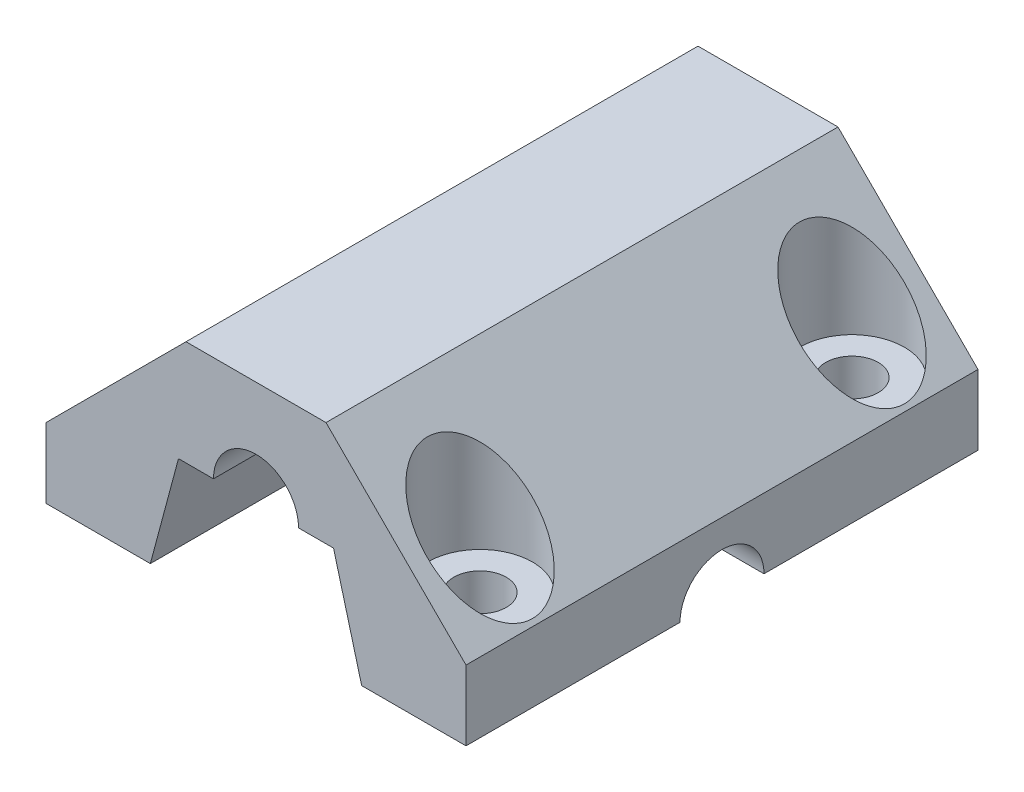
from build123d import *

# Parameters (mm, degrees)
SKETCH1_W           = 60
SKETCH1_H           = 30
BOSS_EXTRUDE1_DEPTH = 36.57
CUT_EXTRUDE1_DEPTH  = 60
CUT_EXTRUDE2_REACH  = 82.464
CUT_EXTRUDE3_DEPTH  = 73.14
SKETCH5_R           = 3.75
CUT_EXTRUDE4_DEPTH  = 30
SKETCH6_R           = 7.5
CUT_EXTRUDE5_DEPTH  = 20


with BuildPart() as part:
    # Sketch1 → Boss-Extrude1 (new, symmetric)
    with BuildSketch(Plane.XY):
        Rectangle(SKETCH1_W, SKETCH1_H)
    extrude(amount=BOSS_EXTRUDE1_DEPTH, both=True)

    # Sketch2 → Cut-Extrude1 (cut)
    with BuildSketch(Plane(origin=(30, 0, 0), x_dir=(0, 0, -1), z_dir=(1, 0, 0))):
        with BuildLine():
            ThreePointArc((6, -15), (0, -9), (-6, -15))
            Line((-6, -15), (6, -15))
        make_face()
    extrude(amount=-CUT_EXTRUDE1_DEPTH, mode=Mode.SUBTRACT)

    # Cut-Extrude2: up to this face of the body (flat: up to its plane)
    cut_extrude2_end = Plane(part.part.faces().sort_by_distance((0, 0, -36.57))[0])
    # Sketch3 → Cut-Extrude2 (cut, up to the picked face)
    with BuildSketch(Plane.XY.offset(36.57), mode=Mode.PRIVATE) as cut_extrude2_sk1:
        with BuildLine():
            Line((6.075, 0), (11.075, 0))
            Line((11.075, 0), (15.094237886, -15))
            Line((15.094237886, -15), (-15.094237886, -15))
            Line((-15.094237886, -15), (-11.075, 0))
            Line((-11.075, 0), (-6.075, 0))
            ThreePointArc((-6.075, 0), (0, 6.075), (6.075, 0))
        make_face()
    cut_extrude2_tool1 = split(extrude(cut_extrude2_sk1.sketch, amount=-CUT_EXTRUDE2_REACH, mode=Mode.PRIVATE), bisect_by=cut_extrude2_end, keep=Keep.BOTH, mode=Mode.PRIVATE)
    add(cut_extrude2_tool1.solids().sort_by(Axis((0, -6.537689, 36.57), (0, 0, -1)))[0], mode=Mode.SUBTRACT)

    # Sketch4 → Cut-Extrude3 (cut)
    with BuildSketch(Plane.XY.offset(36.57)):
        Polygon((30, 15), (30, -5), (10, 15), align=None)
        Polygon((-30, 15), (-30, -5), (-10, 15), align=None)
    extrude(amount=-CUT_EXTRUDE3_DEPTH, mode=Mode.SUBTRACT)

    # Sketch5 → Cut-Extrude4 (cut)
    with BuildSketch(Plane(origin=(0, 15, 0), x_dir=(1, 0, 0), z_dir=(0, 1, 0))):
        with Locations(Location((22, -26.57, 0), (0, 0, 180))):
            Circle(SKETCH5_R)
        with Locations(Location((-22, -26.57, 0), (0, 0, 180))):
            Circle(SKETCH5_R)
        with Locations(Location((22, 26.57, 0), (0, 0, 180))):
            Circle(SKETCH5_R)
        with Locations(Location((-22, 26.57, 0), (0, 0, 180))):
            Circle(SKETCH5_R)
    extrude(amount=-CUT_EXTRUDE4_DEPTH, mode=Mode.SUBTRACT)

    # Sketch6 → Cut-Extrude5 (cut)
    with BuildSketch(Plane(origin=(0, 15, 0), x_dir=(1, 0, 0), z_dir=(0, 1, 0))):
        with Locations(Location((22, -26.57, 0), (0, 0, 180))):
            Circle(SKETCH6_R)
        with Locations((-22, -26.57)):
            Circle(SKETCH6_R)
        with Locations(Location((22, 26.57, 0), (0, 0, 180))):
            Circle(SKETCH6_R)
        with Locations(Location((-22, 26.57, 0), (0, 0, 180))):
            Circle(SKETCH6_R)
    extrude(amount=-CUT_EXTRUDE5_DEPTH, mode=Mode.SUBTRACT)


solid = part.part
